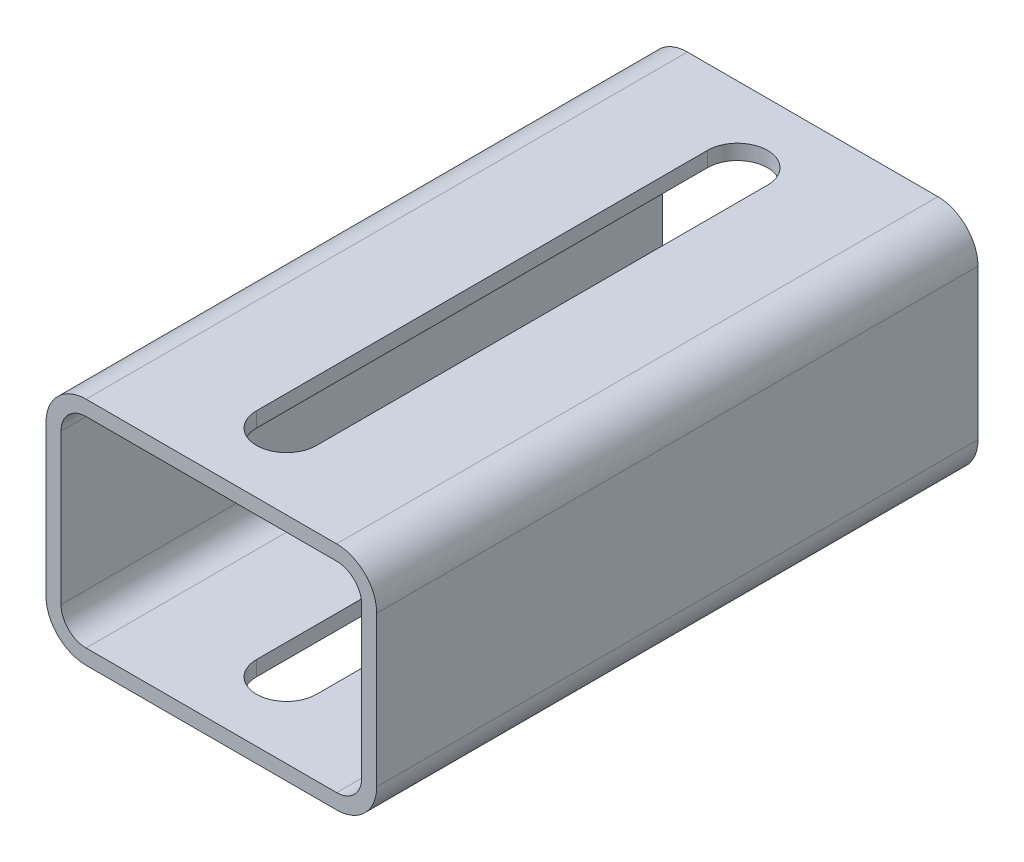
from build123d import *

# Parameters (mm, degrees)
EXTRUDE_THIN1_DEPTH = 60
CUT_EXTRUDE1_DEPTH  = 83.492423895


with BuildPart() as part:
    # Sketch1 → Extrude-Thin1 (new, symmetric)
    with BuildSketch(Plane.XY):
        with BuildLine():
            Line((-33, 15), (-33, -15))
            ThreePointArc((-33, -15), (-30.656854249, -20.656854249), (-25, -23))
            Line((-25, -23), (25, -23))
            ThreePointArc((25, -23), (30.656854249, -20.656854249), (33, -15))
            Line((33, -15), (33, 15))
            ThreePointArc((33, 15), (30.656854249, 20.656854249), (25, 23))
            Line((25, 23), (-25, 23))
            ThreePointArc((-25, 23), (-30.656854249, 20.656854249), (-33, 15))
        make_face()
        with BuildLine():
            Line((-30, 15), (-30, -15))
            ThreePointArc((-30, -15), (-28.535533906, -18.535533906), (-25, -20))
            Line((-25, -20), (25, -20))
            ThreePointArc((25, -20), (28.535533906, -18.535533906), (30, -15))
            Line((30, -15), (30, 15))
            ThreePointArc((30, 15), (28.535533906, 18.535533906), (25, 20))
            Line((25, 20), (-25, 20))
            ThreePointArc((-25, 20), (-28.535533906, 18.535533906), (-30, 15))
        make_face(mode=Mode.SUBTRACT)
    extrude(amount=EXTRUDE_THIN1_DEPTH, both=True)

    # Sketch3 → Cut-Extrude1 (cut, through all)
    with BuildSketch(Plane(origin=(0, 23, 0), x_dir=(1, 0, 0), z_dir=(0, 1, 0))):
        with BuildLine():
            Line((6, 45), (6, -45))
            ThreePointArc((6, -45), (0, -51), (-6, -45))
            Line((-6, -45), (-6, 45))
            ThreePointArc((-6, 45), (0, 51), (6, 45))
        make_face()
    extrude(amount=-CUT_EXTRUDE1_DEPTH, mode=Mode.SUBTRACT)


solid = part.part
